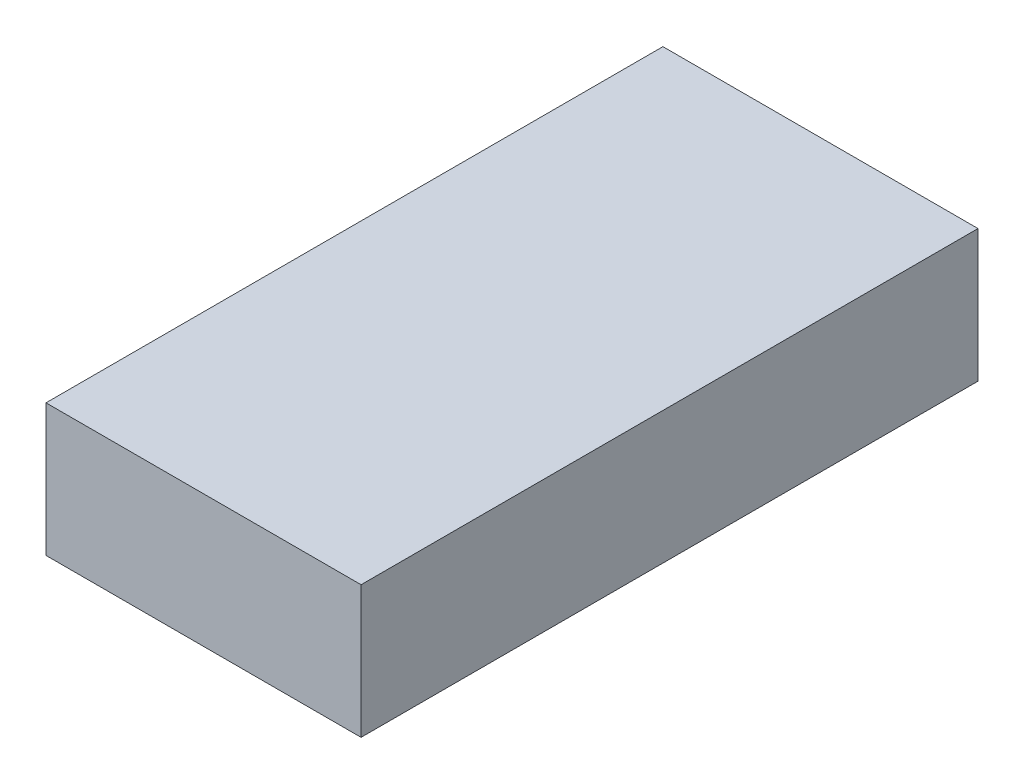
from build123d import *

# Parameters (mm, degrees)
BOSS_EXTRUDE1_DEPTH = 4
SKETCH2_W           = 14.3
SKETCH2_H           = 28
BOSS_EXTRUDE2_DEPTH = 2


with BuildPart() as part:
    # Sketch1 → Boss-Extrude1 (new body)
    with BuildSketch(Plane(origin=(0, 0, 0), x_dir=(1, 0, 0), z_dir=(0, 1, 0))):
        Polygon((-5.65, -12.5), (-5.65, 12.5), (-5.65, 14), (-7.15, 14), (-7.15, -14), (7.15, -14), (7.15, 14), (5.65, 14), (5.65, 12.5), (5.65, -12.5), align=None)
    extrude(amount=BOSS_EXTRUDE1_DEPTH)

    # Sketch2 → Boss-Extrude2 (add)
    with BuildSketch(Plane(origin=(0, 4, 0), x_dir=(1, 0, 0), z_dir=(0, 1, 0))):
        Rectangle(SKETCH2_W, SKETCH2_H)
    extrude(amount=BOSS_EXTRUDE2_DEPTH)


solid = part.part
